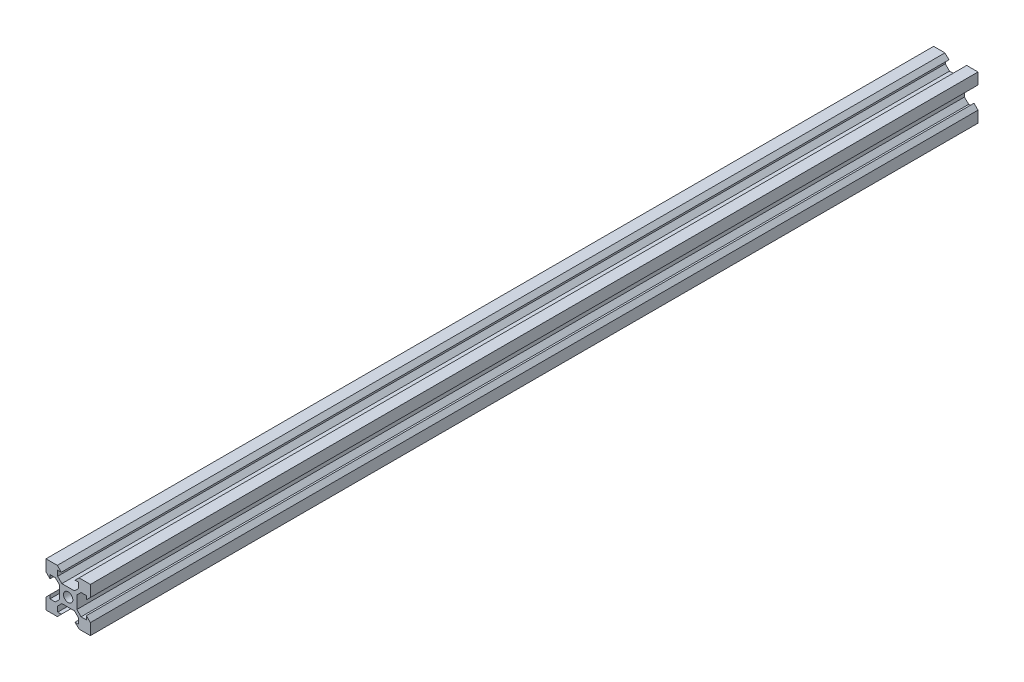
from build123d import *

# Parameters (mm, degrees)
SKETCH1_R           = 2.1
BOSS_EXTRUDE1_DEPTH = 200


with BuildPart() as part:
    # Sketch1 → Boss-Extrude1 (new, symmetric)
    with BuildSketch(Plane.XY):
        Polygon((-3.900660172, -2.84), (-3.900660172, 2.84), (-5.800660172, 4.74), (-8.2, 4.74), (-8.2, 3.1), (-10, 4.9), (-10, 10), (-4.9, 10), (-3.1, 8.2), (-4.74, 8.2), (-4.74, 5.800660172), (-2.84, 3.900660172), (0, 3.900660172), (2.84, 3.900660172), (4.74, 5.800660172), (4.74, 8.2), (3.1, 8.2), (4.9, 10), (10, 10), (10, 4.9), (8.2, 3.1), (8.2, 4.74), (5.800660172, 4.74), (3.900660172, 2.84), (3.900660172, -2.84), (5.800660172, -4.74), (8.2, -4.74), (8.2, -3.1), (10, -4.9), (10, -10), (4.9, -10), (3.1, -8.2), (4.74, -8.2), (4.74, -5.800660172), (2.84, -3.900660172), (0, -3.900660172), (-2.84, -3.900660172), (-4.74, -5.800660172), (-4.74, -8.2), (-3.1, -8.2), (-4.9, -10), (-10, -10), (-10, -4.9), (-8.2, -3.1), (-8.2, -4.74), (-5.800660172, -4.74), align=None)
        Circle(SKETCH1_R, mode=Mode.SUBTRACT)
    extrude(amount=BOSS_EXTRUDE1_DEPTH, both=True)


solid = part.part
